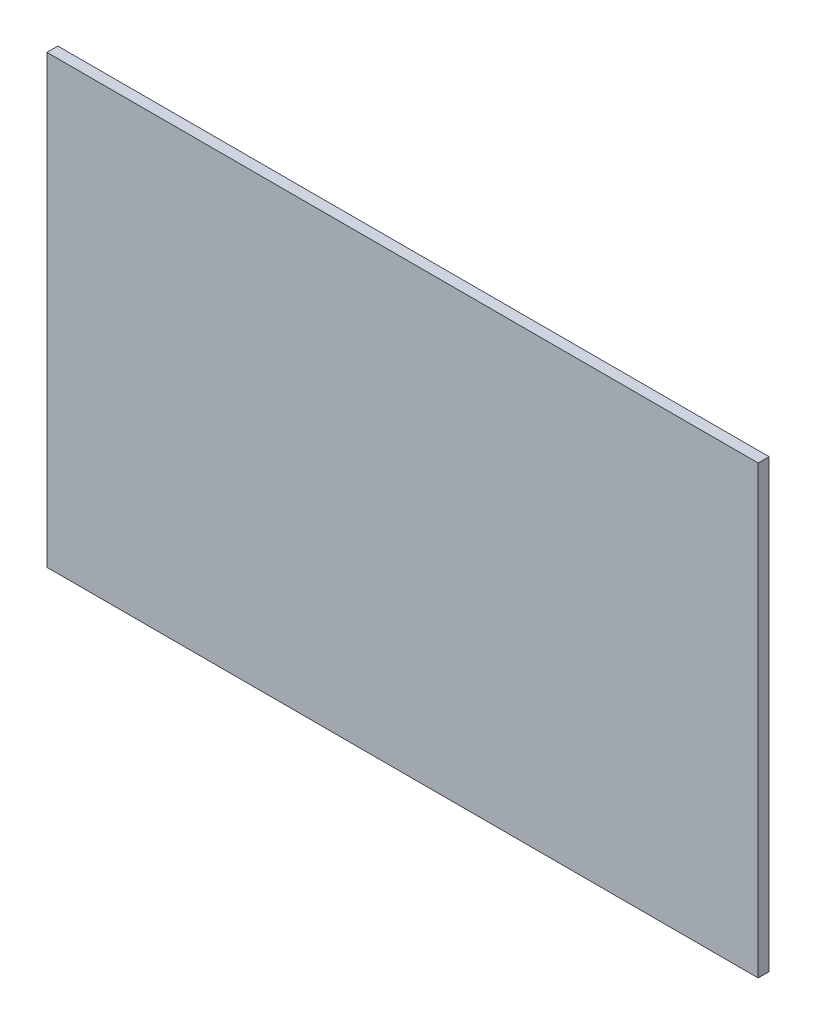
from build123d import *

# Parameters (mm, degrees)
SKETCH_1_W      = 130
SKETCH_1_H      = 81.50225
EXTRUDE_1_DEPTH = 2


with BuildPart() as part:
    # 草圖1 → 填料-伸長1 (new body)
    with BuildSketch(Plane.XY):
        with Locations((-8.156115741, -2.968625)):
            Rectangle(SKETCH_1_W, SKETCH_1_H)
    extrude(amount=EXTRUDE_1_DEPTH)


solid = part.part
